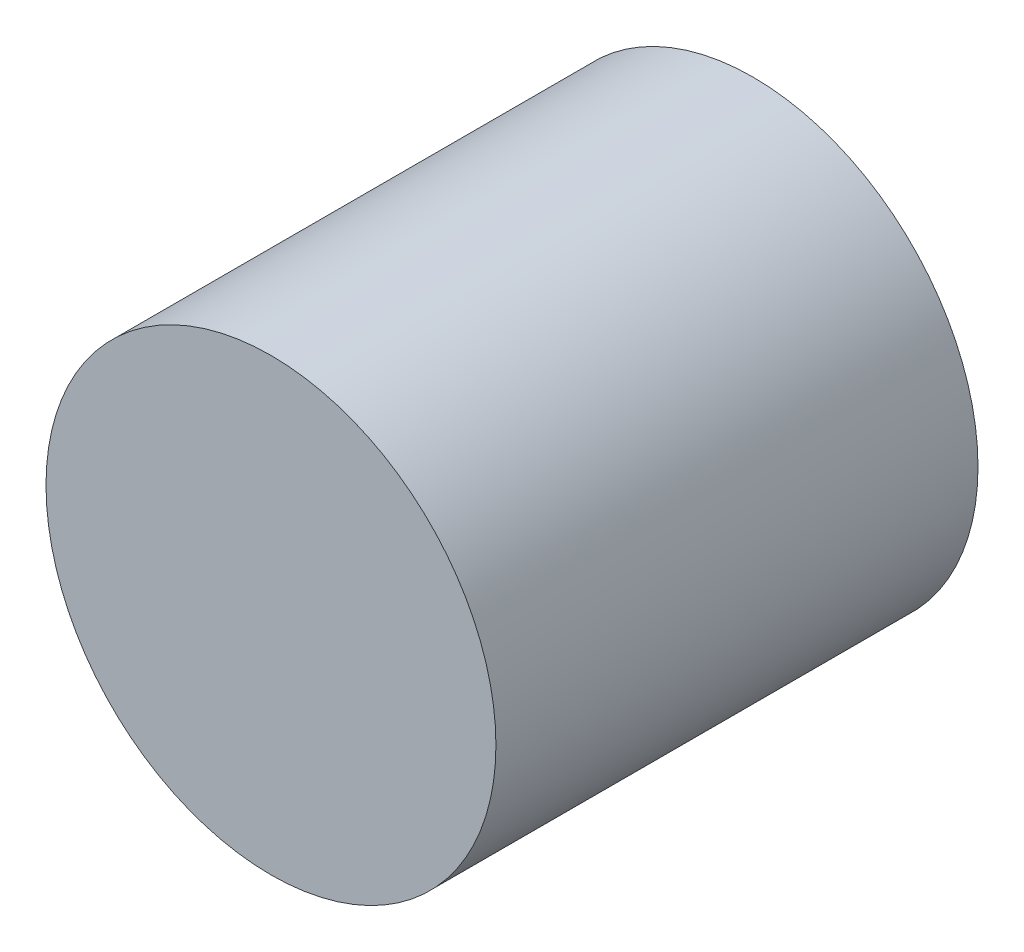
from build123d import *

# Parameters (mm, degrees)
SKETCH1_R           = 14
BOSS_EXTRUDE1_DEPTH = 30


with BuildPart() as part:
    # Sketch1 → Boss-Extrude1 (new body)
    with BuildSketch(Plane.XY):
        Circle(SKETCH1_R)
    extrude(amount=BOSS_EXTRUDE1_DEPTH)


solid = part.part
